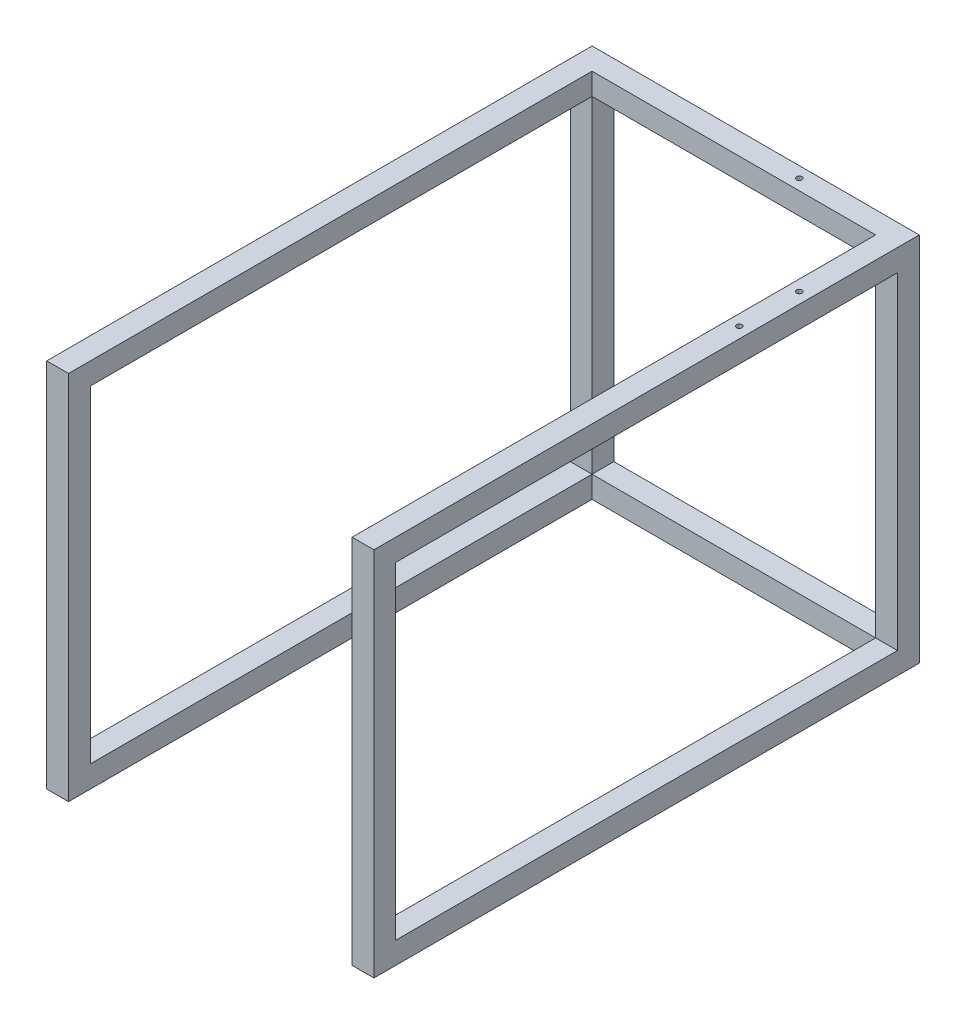
from build123d import *

# Parameters (mm, degrees)
EXTRUDE_THIN1_DEPTH = 100
SKETCH3_W           = 100
SKETCH3_H           = 100
BOSS_EXTRUDE1_DEPTH = 1500
SKETCH5_W           = 100
SKETCH5_H           = 100
SKETCH5_H_2         = 2300
BOSS_EXTRUDE2_DEPTH = 100
CUT_EXTRUDE1_REACH  = 2241.42
SKETCH8_R           = 12.5
CUT_EXTRUDE2_REACH  = 2241.42
SKETCH9_R           = 12.5


with BuildPart() as part:
    # Sketch2 → Extrude-Thin1 (new body)
    with BuildSketch(Plane(origin=(0, 0, 0), x_dir=(1, 0, 0), z_dir=(0, 1, 0))):
        Polygon((750, -1250), (750, 1250), (-750, 1250), (-750, -1250), (-650, -1250), (-650, 1150), (650, 1150), (650, -1250), align=None)
    extrude(amount=EXTRUDE_THIN1_DEPTH)

    # Sketch3 → Boss-Extrude1 (add)
    with BuildSketch(Plane(origin=(0, 100, 0), x_dir=(1, 0, 0), z_dir=(0, 1, 0))):
        with Locations((700, 1200)):
            Rectangle(SKETCH3_W, SKETCH3_H)
        with Locations((-700, 1200)):
            Rectangle(SKETCH3_W, SKETCH3_H)
        with Locations((-700, -1200)):
            Rectangle(SKETCH3_W, SKETCH3_H)
        with Locations((700, -1200)):
            Rectangle(SKETCH3_W, SKETCH3_H)
    extrude(amount=BOSS_EXTRUDE1_DEPTH)

    # Sketch5 → Boss-Extrude2 (add)
    with BuildSketch(Plane(origin=(0, 1600, 0), x_dir=(1, 0, 0), z_dir=(0, 1, 0))):
        Polygon((-650, 1150), (650, 1150), (750, 1150), (750, 1250), (650, 1250), (-650, 1250), align=None)
        Polygon((-650, -1250), (-650, -1150), (-650, 1150), (-750, 1150), (-750, -1150), (-750, -1250), align=None)
        with Locations((-700, 1200)):
            Rectangle(SKETCH5_W, SKETCH5_H)
        with Locations((700, 0)):
            Rectangle(SKETCH5_W, SKETCH5_H_2)
        with Locations((700, -1200)):
            Rectangle(SKETCH5_W, SKETCH5_H)
    extrude(amount=BOSS_EXTRUDE2_DEPTH)

    # Sketch8 → Cut-Extrude1 (cut, up to next)
    with BuildSketch(Plane(origin=(0, 1700, 0), x_dir=(1, 0, 0), z_dir=(0, 1, 0)), mode=Mode.PRIVATE) as cut_extrude1_sk1:
        with Locations(Location((700, 750, 0), (0, 0, 270))):
            Circle(SKETCH8_R)
    cut_extrude1_tool1 = extrude(cut_extrude1_sk1.sketch, amount=-CUT_EXTRUDE1_REACH, mode=Mode.PRIVATE) & part.part
    # Sketch8 → Cut-Extrude1 (cut, up to next)
    with BuildSketch(Plane(origin=(0, 1700, 0), x_dir=(1, 0, 0), z_dir=(0, 1, 0)), mode=Mode.PRIVATE) as cut_extrude1_sk2:
        with Locations(Location((250, 1200, 0), (0, 0, 270))):
            Circle(SKETCH8_R)
    cut_extrude1_tool2 = extrude(cut_extrude1_sk2.sketch, amount=-CUT_EXTRUDE1_REACH, mode=Mode.PRIVATE) & part.part
    add(cut_extrude1_tool1.solids().sort_by_distance((700, 1700, -750))[0], mode=Mode.SUBTRACT)
    add(cut_extrude1_tool2.solids().sort_by_distance((250, 1700, -1200))[0], mode=Mode.SUBTRACT)

    # Sketch9 → Cut-Extrude2 (cut, up to next)
    with BuildSketch(Plane(origin=(0, 1700, 0), x_dir=(1, 0, 0), z_dir=(0, 1, 0)), mode=Mode.PRIVATE) as cut_extrude2_sk1:
        with Locations(Location((700, 475, 0), (0, 0, 270))):
            Circle(SKETCH9_R)
    cut_extrude2_tool1 = extrude(cut_extrude2_sk1.sketch, amount=-CUT_EXTRUDE2_REACH, mode=Mode.PRIVATE) & part.part
    add(cut_extrude2_tool1.solids().sort_by_distance((700, 1700, -475))[0], mode=Mode.SUBTRACT)


solid = part.part
